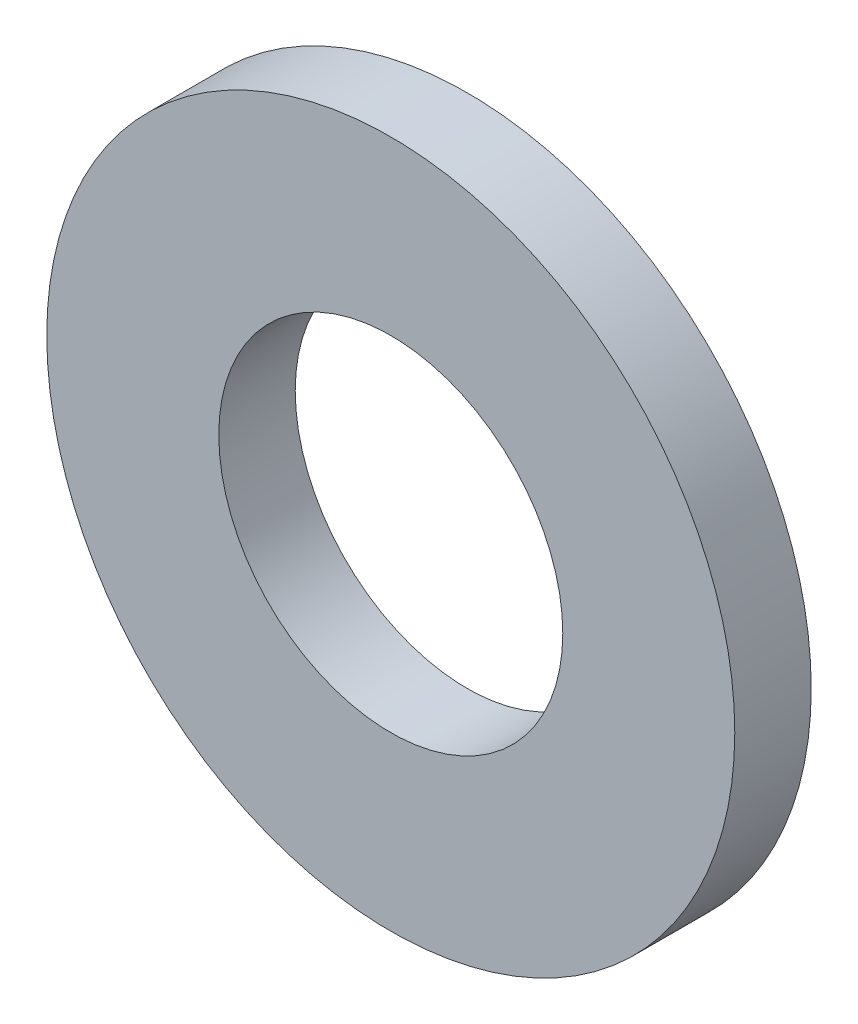
from build123d import *

# Parameters (mm, degrees)
SKETCH_1_R            = 4.5
EXTRUDE_246_DEPTH     = 1
SKETCH_2_R            = 2.25
CUT_EXTRUDE_315_DEPTH = 1


with BuildPart() as part:
    # 草图1 → Extrude 246 (new body)
    with BuildSketch(Plane.XY):
        Circle(SKETCH_1_R)
    extrude(amount=EXTRUDE_246_DEPTH)

    # 草图2 → Cut-Extrude 315 (cut)
    with BuildSketch(Plane.XY):
        Circle(SKETCH_2_R)
    extrude(amount=CUT_EXTRUDE_315_DEPTH, mode=Mode.SUBTRACT)


solid = part.part
